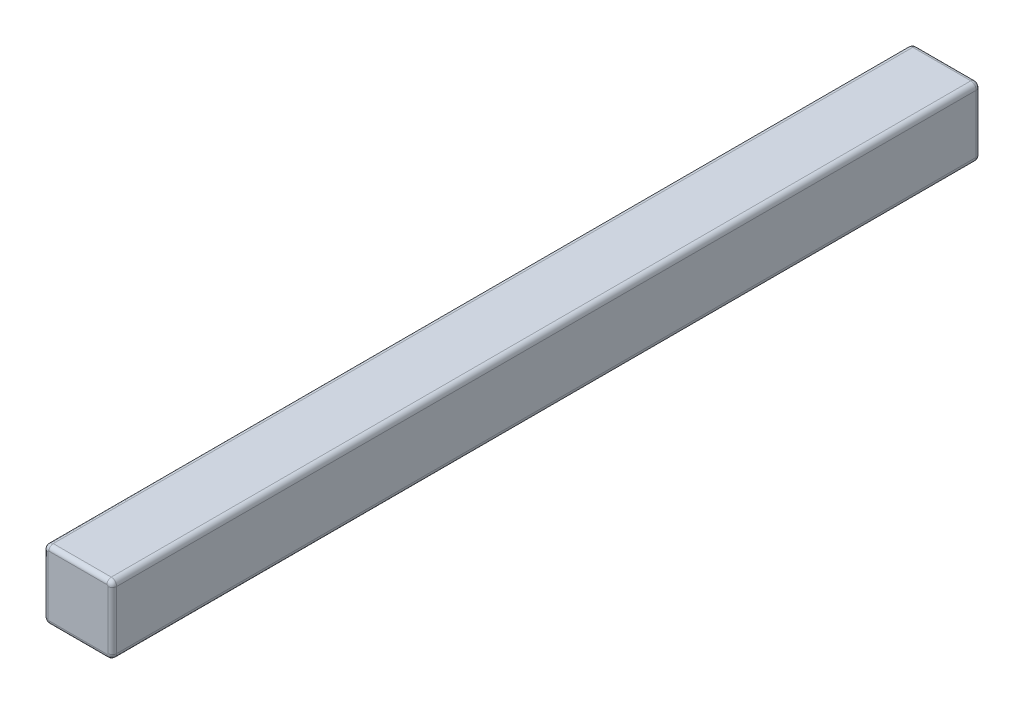
from build123d import *

# Parameters (mm, degrees)
BOSS_EXTRUDE1_DEPTH = 40
FILLET1_R           = 0.2


with BuildPart() as part:
    # Sketch1 → Boss-Extrude1 (new body)
    with BuildSketch(Plane.XY):
        with BuildLine():
            Line((-1.3375, 1.5875), (1.3375, 1.5875))
            ThreePointArc((1.3375, 1.5875), (1.514276695, 1.514276695), (1.5875, 1.3375))
            Line((1.5875, 1.3375), (1.5875, -1.3375))
            ThreePointArc((1.5875, -1.3375), (1.514276695, -1.514276695), (1.3375, -1.5875))
            Line((1.3375, -1.5875), (-1.3375, -1.5875))
            ThreePointArc((-1.3375, -1.5875), (-1.514276695, -1.514276695), (-1.5875, -1.3375))
            Line((-1.5875, -1.3375), (-1.5875, 1.3375))
            ThreePointArc((-1.5875, 1.3375), (-1.514276695, 1.514276695), (-1.3375, 1.5875))
        make_face()
    extrude(amount=BOSS_EXTRUDE1_DEPTH)

    # Fillet1
    fillet1_edges = [part.edges().sort_by_distance(p)[0] for p in [
        (-1.5875, 0, 0),
        (-1.514276695, -1.514276695, 0),
        (0, -1.5875, 0),
        (1.514276695, -1.514276695, 0),
        (1.5875, 0, 0),
        (1.514276695, 1.514276695, 0),
        (0, 1.5875, 0),
        (-1.514276695, 1.514276695, 0),
        (0, 1.5875, 40),
        (1.514276695, 1.514276695, 40),
        (1.5875, 0, 40),
        (1.514276695, -1.514276695, 40),
        (0, -1.5875, 40),
        (-1.514276695, -1.514276695, 40),
        (-1.5875, 0, 40),
        (-1.514276695, 1.514276695, 40),
    ]]
    fillet(fillet1_edges, radius=FILLET1_R)


solid = part.part
